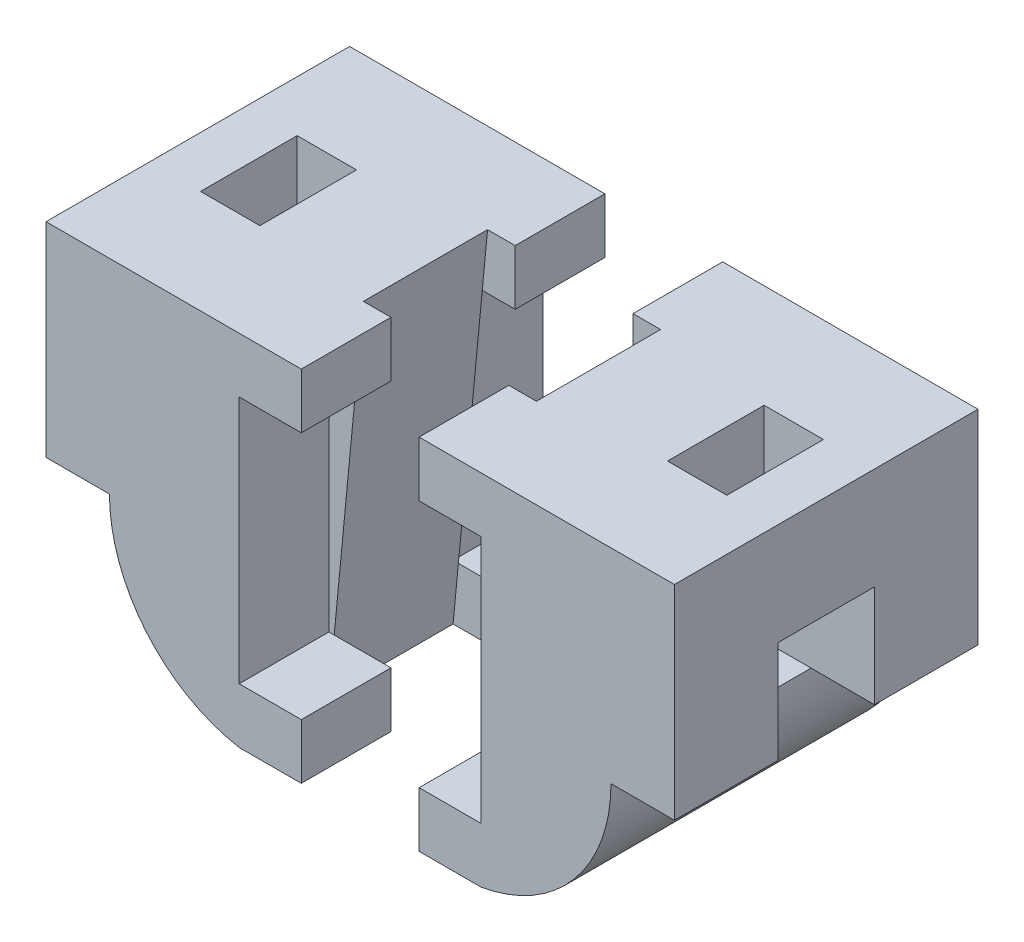
from build123d import *

# Parameters (mm, degrees)
EXTRUDE_1_DEPTH      = 15
EXTRUDE_1_DEPTH_BACK = 29
SKETCH_7_W           = 15
SKETCH_7_H           = 29.591539244
EXTRUDE_3_DEPTH      = 16
SKETCH_11_W          = 7.4
SKETCH_11_H          = 14.795769622
EXTRUDE_13_DEPTH     = 14
SKETCH_13_W          = 13
SKETCH_13_H          = 8
EXTRUDE_16_DEPTH     = 9
EXTRUDE_17_DEPTH     = 18


with BuildPart() as part:
    # 스케치2 → 보스-돌출1 (new, two sides: drawn at the far end of the back side and taken through both)
    with BuildSketch(Plane(origin=(-51.367729061, 0, 0), x_dir=(1, 0, 0), z_dir=(0, 0, 1)).offset(-EXTRUDE_1_DEPTH_BACK)):
        with BuildLine():
            Line((80.908398657, -179.452946096), (68.908398657, -179.452946096))
            Line((68.908398657, -179.452946096), (68.908398657, -231.452946096))
            ThreePointArc((68.908398657, -231.452946096), (82.389621369, -223.671414091), (87.713958083, -209.04448534))
            Line((87.713958083, -209.04448534), (80.908398657, -209.04448534))
            Line((80.908398657, -209.04448534), (80.908398657, -179.452946096))
        make_face()
    extrude(amount=EXTRUDE_1_DEPTH + EXTRUDE_1_DEPTH_BACK)

    # 스케치7 → 보스-돌출3 (add)
    with BuildSketch(Plane(origin=(29.540669597, 0, 0), x_dir=(0, 0, -1), z_dir=(1, 0, 0))):
        with Locations((-7.5, -194.248715718)):
            Rectangle(SKETCH_7_W, SKETCH_7_H)
        with Locations((21.5, -194.248715718)):
            Rectangle(SKETCH_7_W, SKETCH_7_H)
    extrude(amount=EXTRUDE_3_DEPTH)

    # 스케치11 → 보스-돌출13 (add)
    with BuildSketch(Plane(origin=(-11.922476153, 0, -14), x_dir=(1, 0, 0), z_dir=(0, 0, 1))):
        with Locations((53.76314575, -186.850830907)):
            Rectangle(SKETCH_11_W, SKETCH_11_H)
    extrude(amount=EXTRUDE_13_DEPTH)

    # 스케치13 → 보스-돌출16 (add)
    with BuildSketch(Plane.ZY.offset(-17.540669597)):
        with Locations((8.5, -183.452946096)):
            Rectangle(SKETCH_13_W, SKETCH_13_H)
        with Locations((-22.5, -183.452946096)):
            Rectangle(SKETCH_13_W, SKETCH_13_H)
        with Locations((-22.5, -227.452946096)):
            Rectangle(SKETCH_13_W, SKETCH_13_H)
        with Locations((8.5, -227.452946096)):
            Rectangle(SKETCH_13_W, SKETCH_13_H)
    extrude(amount=EXTRUDE_16_DEPTH)

    # 스케치14 → 보스-돌출17 (add)
    with BuildSketch(Plane.XY.offset(-16)):
        Polygon((17.540669597, -179.452946096), (12.540669597, -179.452946096), (17.540669597, -231.452946096), align=None)
    extrude(amount=EXTRUDE_17_DEPTH)


with BuildPart() as body_2:
    # 대칭 복사2: mirrored copy
    add(part.part.mirror(Plane(origin=(0, 0, 0), x_dir=(0, 0, 1), z_dir=(1, 0, 0))))


solid = Compound([part.part, body_2.part])
